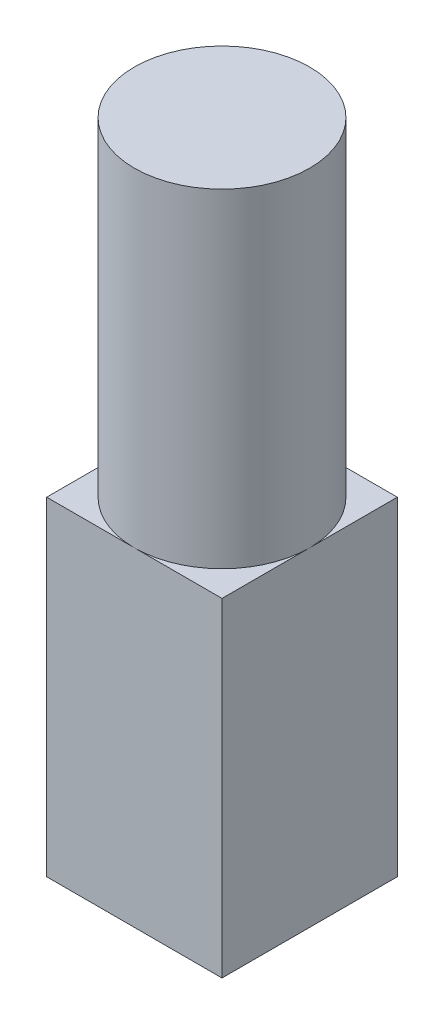
from build123d import *

# Parameters (mm, degrees)
SKETCH1_W           = 1.6
SKETCH1_H           = 1.6
BOSS_EXTRUDE1_DEPTH = 3
SKETCH2_R           = 0.8
BOSS_EXTRUDE2_DEPTH = 3


with BuildPart() as part:
    # Sketch1 → Boss-Extrude1 (new body)
    with BuildSketch(Plane(origin=(0, 0, 0), x_dir=(1, 0, 0), z_dir=(0, 1, 0))):
        with Locations((-86.840937233, -12.437433228)):
            Rectangle(SKETCH1_W, SKETCH1_H)
    extrude(amount=BOSS_EXTRUDE1_DEPTH)

    # Sketch2 → Boss-Extrude2 (add)
    with BuildSketch(Plane(origin=(0, 3, 0), x_dir=(1, 0, 0), z_dir=(0, 1, 0))):
        with Locations(Location((-86.840937233, -12.437433228, 0), (0, 0, 270))):
            Circle(SKETCH2_R)
    extrude(amount=BOSS_EXTRUDE2_DEPTH)


solid = part.part
